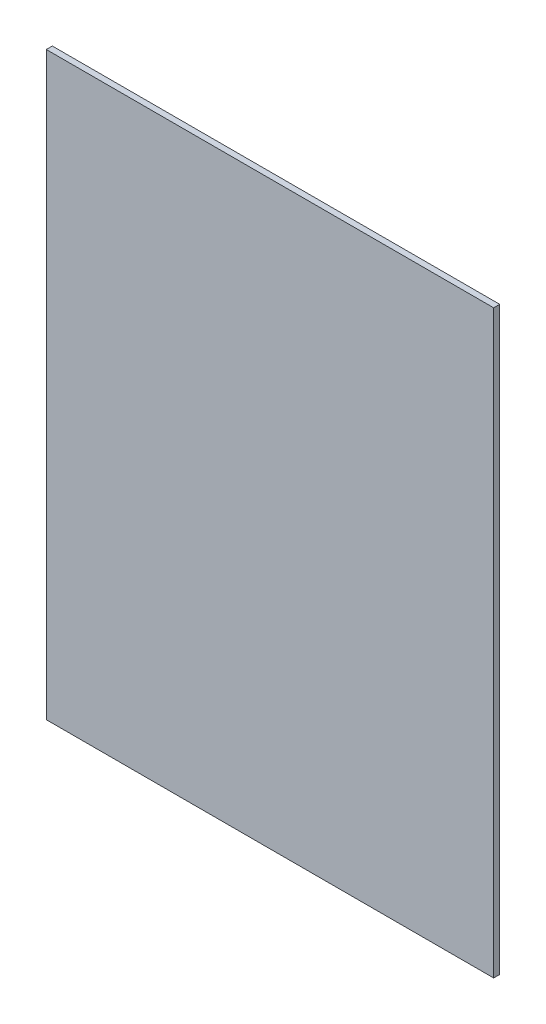
from build123d import *

# Parameters (mm, degrees)
SKETCH1_W           = 234.95
SKETCH1_H           = 304.8
BOSS_EXTRUDE1_DEPTH = 3.175


with BuildPart() as part:
    # Sketch1 → Boss-Extrude1 (new body)
    with BuildSketch(Plane.XY):
        Rectangle(SKETCH1_W, SKETCH1_H)
    extrude(amount=BOSS_EXTRUDE1_DEPTH)


solid = part.part
